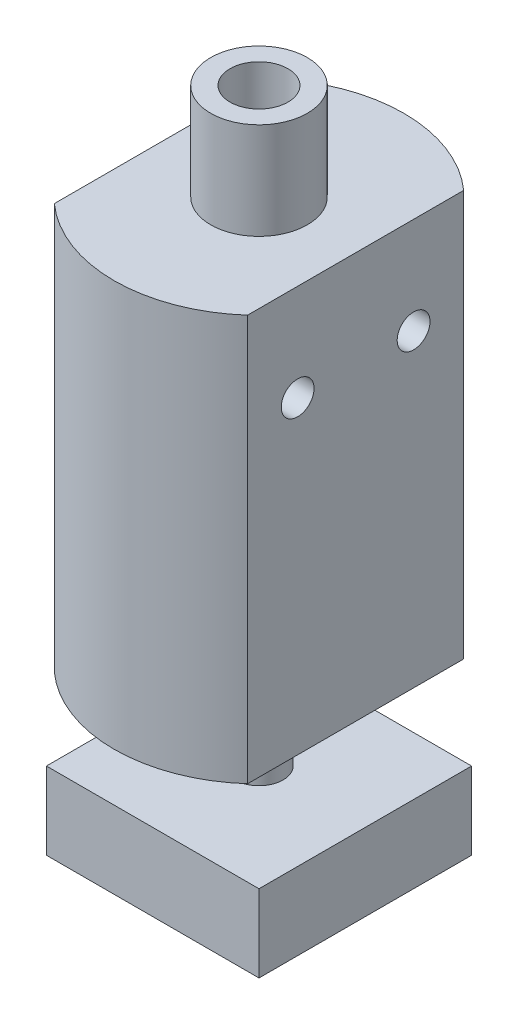
from build123d import *

# Parameters (mm, degrees)
CUT_EXTRUDE_2_DEPTH      = 57.160484328
CUT_EXTRUDE_2_DEPTH_BACK = 57.160484328
SKETCH_2_OUTSIDE_W       = 49.234
SKETCH_2_OUTSIDE_H       = 94.234
SKETCH_2_OUTSIDE_W_2     = 20
SKETCH_2_OUTSIDE_H_2     = 75
EXTRUDE_1_DEPTH          = 11
EXTRUDE_1_DEPTH_BACK     = 11
SKETCH_4_W               = 22
SKETCH_4_H               = 8
SKETCH_5_R               = 1.7
CUT_EXTRUDE_3_DEPTH      = 59.051701095


with BuildPart() as part:
    # 草图1 → 旋转1 (revolve)
    with BuildSketch(Plane.XY):
        Polygon((2.5, 0), (15, 0), (15, 42), (5, 42), (5, 52), (3, 52), (3, 42), (0, 42), (0, 0), (0, -23), (0.2, -23), (2.5, -19.016283143), align=None)
    revolve(axis=Axis((0, 0, 0), (0, 1, 0)))

    # 草图2 outside → 切除-拉伸2 (cut, two sides: drawn at the far end of the back side and taken through both)
    with BuildSketch(Plane.XY.offset(-CUT_EXTRUDE_2_DEPTH_BACK)):
        with Locations((0, 14.5)):
            Rectangle(SKETCH_2_OUTSIDE_W, SKETCH_2_OUTSIDE_H)
        with Locations((0, 14.5)):
            Rectangle(SKETCH_2_OUTSIDE_W_2, SKETCH_2_OUTSIDE_H_2, mode=Mode.SUBTRACT)
    extrude(amount=CUT_EXTRUDE_2_DEPTH + CUT_EXTRUDE_2_DEPTH_BACK, mode=Mode.SUBTRACT)

    # 草图4 → 凸台-拉伸1 (add, two sides: drawn at the far end of the back side and taken through both)
    with BuildSketch(Plane.XY.offset(-EXTRUDE_1_DEPTH_BACK)):
        with Locations((0, -13)):
            Rectangle(SKETCH_4_W, SKETCH_4_H)
    extrude(amount=EXTRUDE_1_DEPTH + EXTRUDE_1_DEPTH_BACK)

    # 草图5 → 切除-拉伸3 (cut, through all)
    with BuildSketch(Plane(origin=(10, 0, 0), x_dir=(0, 0, -1), z_dir=(1, 0, 0))):
        with Locations((-6, 32)):
            Circle(SKETCH_5_R)
        with Locations((6, 32)):
            Circle(SKETCH_5_R)
    extrude(amount=-CUT_EXTRUDE_3_DEPTH, mode=Mode.SUBTRACT)


solid = part.part
